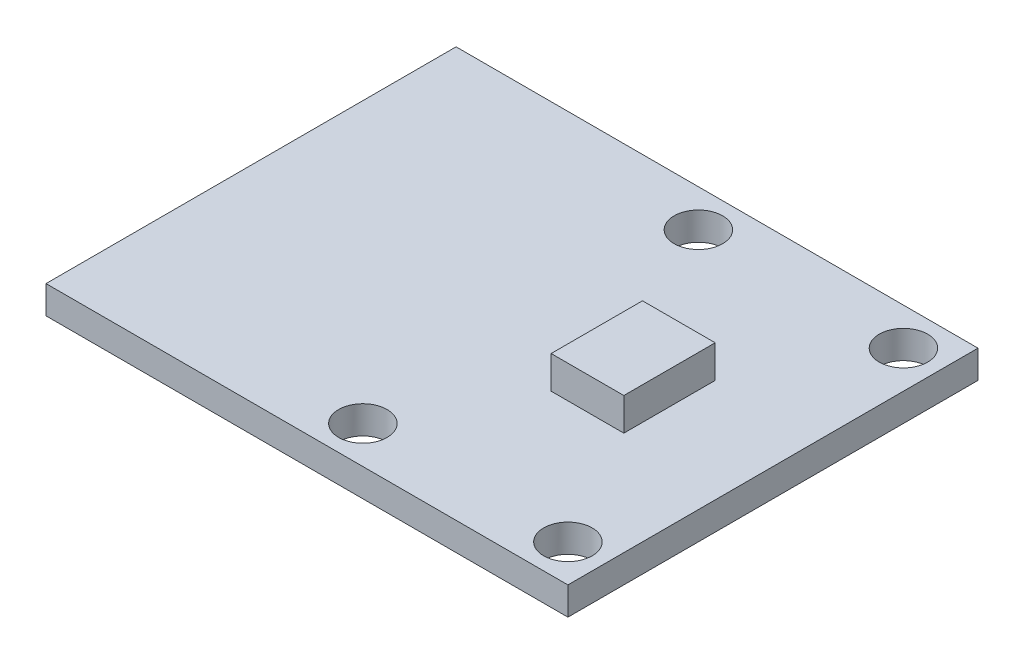
from build123d import *

# Parameters (mm, degrees)
SKETCH1_W           = 28
SKETCH1_H           = 22
BOSS_EXTRUDE1_DEPTH = 1.5
SKETCH2_W           = 3.9
SKETCH2_H           = 4.9
BOSS_EXTRUDE2_DEPTH = 1.75
SKETCH3_R           = 1.3
CUT_EXTRUDE1_DEPTH  = 1.75


with BuildPart() as part:
    # Sketch1 → Boss-Extrude1 (new body)
    with BuildSketch(Plane(origin=(0, 0, 0), x_dir=(1, 0, 0), z_dir=(0, 1, 0))):
        Rectangle(SKETCH1_W, SKETCH1_H)
    extrude(amount=BOSS_EXTRUDE1_DEPTH)

    # Sketch2 → Boss-Extrude2 (add)
    with BuildSketch(Plane(origin=(0, 1.5, 0), x_dir=(1, 0, 0), z_dir=(0, 1, 0))):
        with Locations((6.5, 0)):
            Rectangle(SKETCH2_W, SKETCH2_H)
    extrude(amount=BOSS_EXTRUDE2_DEPTH)

    # Sketch3 → Cut-Extrude1 (cut)
    with BuildSketch(Plane(origin=(0, 1.5, 0), x_dir=(1, 0, 0), z_dir=(0, 1, 0))):
        with Locations(Location((12, -9, 0), (0, 0, 270))):
            Circle(SKETCH3_R)
        with Locations(Location((1, -9, 0), (0, 0, 270))):
            Circle(SKETCH3_R)
        with Locations(Location((12, 9, 0), (0, 0, 90))):
            Circle(SKETCH3_R)
        with Locations(Location((1, 9, 0), (0, 0, 90))):
            Circle(SKETCH3_R)
    extrude(amount=-CUT_EXTRUDE1_DEPTH, mode=Mode.SUBTRACT)


solid = part.part
